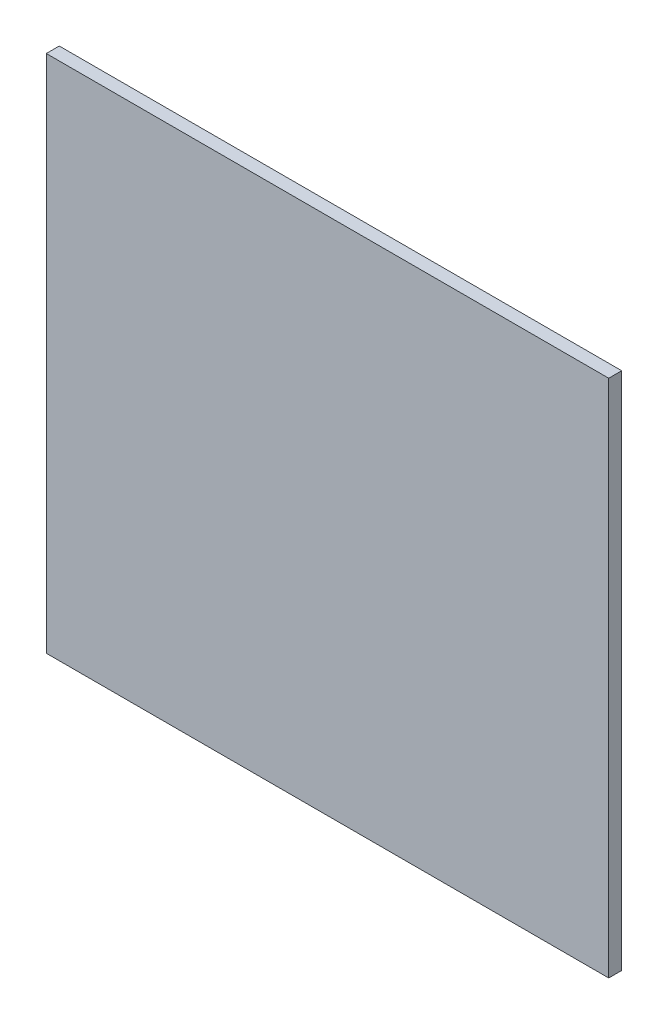
from build123d import *

# Parameters (mm, degrees)
SKETCH1_W           = 137.5156
SKETCH1_H           = 127
BOSS_EXTRUDE1_DEPTH = 3.175


with BuildPart() as part:
    # Sketch1 → Boss-Extrude1 (new body)
    with BuildSketch(Plane.XY):
        Rectangle(SKETCH1_W, SKETCH1_H)
    extrude(amount=BOSS_EXTRUDE1_DEPTH)


solid = part.part
